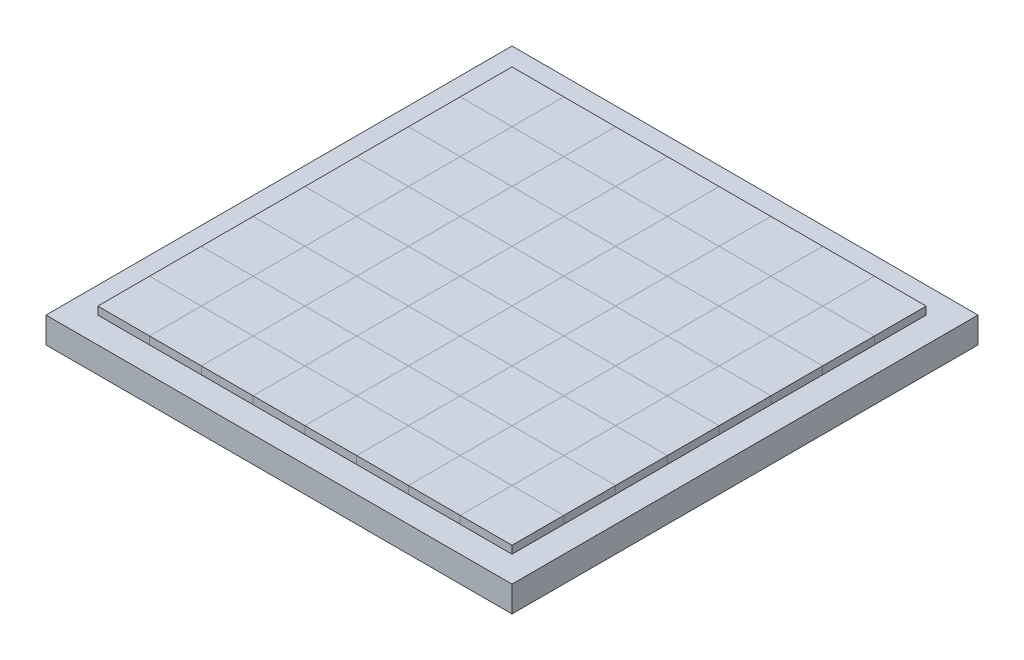
from build123d import *

# Parameters (mm, degrees)
SKETCH3_W            = 228.6
SKETCH3_H            = 228.6
BOSS_EXTRUDE3_DEPTH  = 12.7
SKETCH4_W            = 25.4
SKETCH4_H            = 25.4
BOSS_EXTRUDE4_DEPTH  = 3.81
LPATTERN1_COUNT      = 4
LPATTERN1_PITCH      = 50.8
LPATTERN1_COUNT_DIR2 = 4
LPATTERN1_PITCH_DIR2 = 50.8
SKETCH5_W            = 25.4
SKETCH5_H            = 25.4
BOSS_EXTRUDE6_DEPTH  = 3.81
LPATTERN2_COUNT      = 4
LPATTERN2_PITCH      = 50.8
LPATTERN2_COUNT_DIR2 = 4
LPATTERN2_PITCH_DIR2 = 50.8
SKETCH6_W            = 25.4
SKETCH6_H            = 25.4
BOSS_EXTRUDE7_DEPTH  = 3.81
LPATTERN3_COUNT      = 4
LPATTERN3_PITCH      = 50.8
LPATTERN3_COUNT_DIR2 = 4
LPATTERN3_PITCH_DIR2 = 50.8
SKETCH7_W            = 25.4
SKETCH7_H            = 25.4
BOSS_EXTRUDE8_DEPTH  = 3.81
LPATTERN4_COUNT      = 4
LPATTERN4_PITCH      = 50.8
LPATTERN4_COUNT_DIR2 = 4
LPATTERN4_PITCH_DIR2 = 50.8


with BuildPart() as part:
    # Sketch3 → Boss-Extrude3 (new body)
    with BuildSketch(Plane(origin=(0, 0, 0), x_dir=(1, 0, 0), z_dir=(0, 1, 0))):
        Rectangle(SKETCH3_W, SKETCH3_H)
    extrude(amount=BOSS_EXTRUDE3_DEPTH)

    # Sketch4 → Boss-Extrude4 (add)
    with BuildSketch(Plane(origin=(0, 12.7, 0), x_dir=(1, 0, 0), z_dir=(0, 1, 0))):
        with Locations((-88.9, 88.9)):
            Rectangle(SKETCH4_W, SKETCH4_H)
    boss_extrude4 = extrude(amount=BOSS_EXTRUDE4_DEPTH)

    # LPattern1: Boss-Extrude4 4 × 4
    with Locations(*[(i * LPATTERN1_PITCH, 0, j * LPATTERN1_PITCH_DIR2) for i in range(LPATTERN1_COUNT) for j in range(LPATTERN1_COUNT_DIR2) if (i, j) != (0, 0)]):
        add(boss_extrude4)


with BuildPart() as body_2:
    # Sketch5 → Boss-Extrude6 (new body)
    with BuildSketch(Plane(origin=(0, 12.7, 0), x_dir=(1, 0, 0), z_dir=(0, 1, 0))):
        with Locations((-63.5, 88.9)):
            Rectangle(SKETCH5_W, SKETCH5_H)
    boss_extrude6 = extrude(amount=BOSS_EXTRUDE6_DEPTH)


with BuildPart() as lpattern2_1:
    # LPattern2: Boss-Extrude6 4 × 4
    with Locations(*[(i * LPATTERN2_PITCH, 0, j * LPATTERN2_PITCH_DIR2) for i in range(LPATTERN2_COUNT) for j in range(LPATTERN2_COUNT_DIR2) if (i, j) != (0, 0)]):
        add(boss_extrude6)


with BuildPart() as body_18:
    # Sketch6 → Boss-Extrude7 (new body)
    with BuildSketch(Plane(origin=(0, 12.7, 0), x_dir=(1, 0, 0), z_dir=(0, 1, 0))):
        with Locations((-88.9, 63.5)):
            Rectangle(SKETCH6_W, SKETCH6_H)
    boss_extrude7 = extrude(amount=BOSS_EXTRUDE7_DEPTH)


with BuildPart() as lpattern3_1:
    # LPattern3: Boss-Extrude7 4 × 4
    with Locations(*[(i * LPATTERN3_PITCH, 0, j * LPATTERN3_PITCH_DIR2) for i in range(LPATTERN3_COUNT) for j in range(LPATTERN3_COUNT_DIR2) if (i, j) != (0, 0)]):
        add(boss_extrude7)


with BuildPart() as body_34:
    # Sketch7 → Boss-Extrude8 (new body)
    with BuildSketch(Plane(origin=(0, 12.7, 0), x_dir=(1, 0, 0), z_dir=(0, 1, 0))):
        with Locations((-63.5, 63.5)):
            Rectangle(SKETCH7_W, SKETCH7_H)
    boss_extrude8 = extrude(amount=BOSS_EXTRUDE8_DEPTH)


with BuildPart() as lpattern4_1:
    # LPattern4: Boss-Extrude8 4 × 4
    with Locations(*[(i * LPATTERN4_PITCH, 0, j * LPATTERN4_PITCH_DIR2) for i in range(LPATTERN4_COUNT) for j in range(LPATTERN4_COUNT_DIR2) if (i, j) != (0, 0)]):
        add(boss_extrude8)


solid = Compound([part.part, body_2.part, lpattern2_1.part, body_18.part, lpattern3_1.part, body_34.part, lpattern4_1.part])
